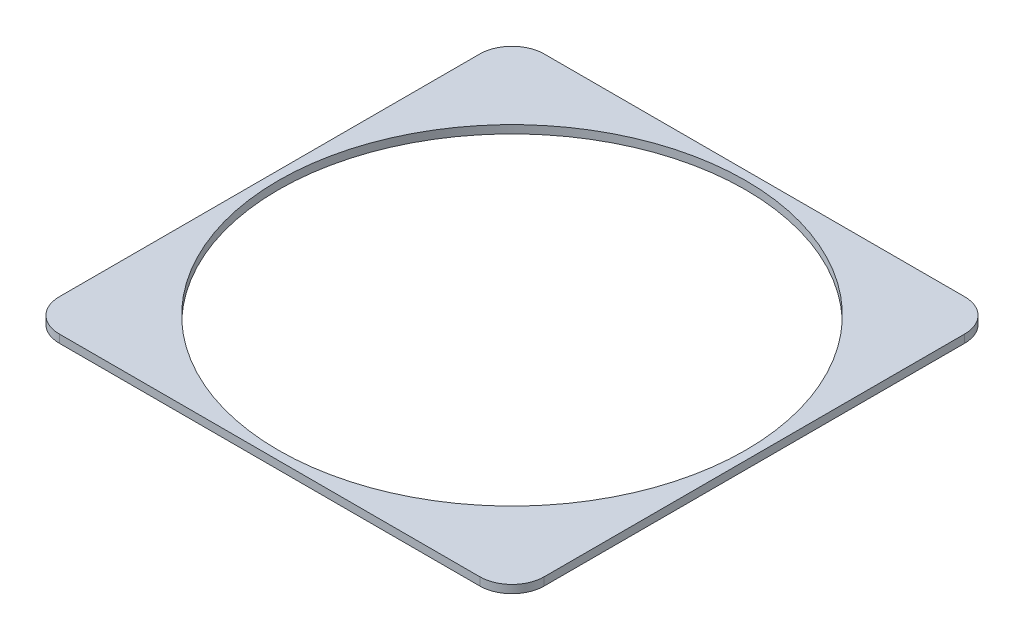
from build123d import *

# Parameters (mm, degrees)
SKETCH1_W           = 150.5
SKETCH1_H           = 150.5
SKETCH1_R           = 72.5
BOSS_EXTRUDE1_DEPTH = 2.5
FILLET1_R           = 10


with BuildPart() as part:
    # Sketch1 → Boss-Extrude1 (new body)
    with BuildSketch(Plane(origin=(0, 0, 0), x_dir=(1, 0, 0), z_dir=(0, 1, 0))):
        Rectangle(SKETCH1_W, SKETCH1_H)
        with Locations(Location((0, 0, 0), (0, 0, 270))):
            Circle(SKETCH1_R, mode=Mode.SUBTRACT)
    extrude(amount=BOSS_EXTRUDE1_DEPTH)

    # Fillet1
    fillet1_edges = [part.edges().sort_by_distance(p)[0] for p in [
        (75.25, 1.25, 75.25),
        (-75.25, 1.25, 75.25),
        (-75.25, 1.25, -75.25),
        (75.25, 1.25, -75.25),
    ]]
    fillet(fillet1_edges, radius=FILLET1_R)


solid = part.part
